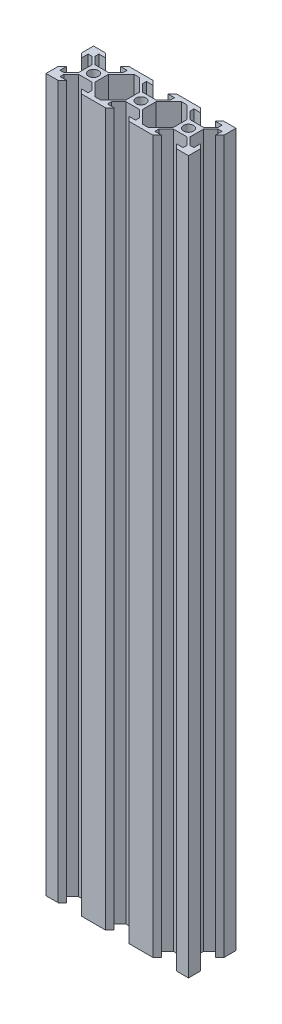
from build123d import *

# Parameters (mm, degrees)
EXTRUDE_1_DEPTH = 300


with BuildPart() as part:
    # 草图1 → 凸台-拉伸1 (new body)
    with BuildSketch(Plane(origin=(0, 0, 0), x_dir=(1, 0, 0), z_dir=(0, 1, 0))):
        with BuildLine():
            Line((-3.476396103, 2.84), (-3.476396103, 0))
            Line((-3.476396103, 0), (-2.1, 0))
            ThreePointArc((-2.1, 0), (-1.48492424, 1.48492424), (0, 2.1))
            Line((0, 2.1), (0, 3.476396103))
            Line((0, 3.476396103), (-2.84, 3.476396103))
            Line((-2.84, 3.476396103), (-5.923603897, 6.56))
            Line((-5.923603897, 6.56), (-5.923603897, 8.2))
            Line((-5.923603897, 8.2), (-3.1, 8.2))
            Line((-3.1, 8.2), (-4.9, 10))
            Line((-4.9, 10), (-10, 10))
            Line((-10, 10), (-10, 4.9))
            Line((-10, 4.9), (-8.2, 3.1))
            Line((-8.2, 3.1), (-8.2, 5.923603897))
            Line((-8.2, 5.923603897), (-6.56, 5.923603897))
            Line((-6.56, 5.923603897), (-3.476396103, 2.84))
        make_face()
        with BuildLine():
            Line((-2.1, 0), (-3.476396103, 0))
            Line((-3.476396103, 0), (-3.476396103, -2.84))
            Line((-3.476396103, -2.84), (-6.56, -5.923603897))
            Line((-6.56, -5.923603897), (-8.2, -5.923603897))
            Line((-8.2, -5.923603897), (-8.2, -3.1))
            Line((-8.2, -3.1), (-10, -4.9))
            Line((-10, -4.9), (-10, -10))
            Line((-10, -10), (-4.9, -10))
            Line((-4.9, -10), (-3.1, -8.2))
            Line((-3.1, -8.2), (-5.923603897, -8.2))
            Line((-5.923603897, -8.2), (-5.923603897, -6.56))
            Line((-5.923603897, -6.56), (-2.84, -3.476396103))
            Line((-2.84, -3.476396103), (0, -3.476396103))
            Line((0, -3.476396103), (0, -2.1))
            ThreePointArc((0, -2.1), (-1.48492424, -1.48492424), (-2.1, 0))
        make_face()
        with BuildLine():
            ThreePointArc((2.1, 0), (1.48492424, -1.48492424), (0, -2.1))
            Line((0, -2.1), (0, -3.476396103))
            Line((0, -3.476396103), (2.84, -3.476396103))
            Line((2.84, -3.476396103), (5.923603897, -6.56))
            Line((5.923603897, -6.56), (5.923603897, -8.2))
            Line((5.923603897, -8.2), (3.1, -8.2))
            Line((3.1, -8.2), (4.9, -10))
            Line((4.9, -10), (15.1, -10))
            Line((15.1, -10), (16.9, -8.2))
            Line((16.9, -8.2), (14.076396103, -8.2))
            Line((14.076396103, -8.2), (14.076396103, -6.56))
            Line((14.076396103, -6.56), (17.16, -3.476396103))
            Line((17.16, -3.476396103), (20, -3.476396103))
            Line((20, -3.476396103), (20, -2.1))
            ThreePointArc((20, -2.1), (18.51507576, -1.48492424), (17.9, 0))
            Line((17.9, 0), (16.523603897, 0))
            Line((16.523603897, 0), (16.523603897, -2.84))
            Line((16.523603897, -2.84), (13.44, -5.923603897))
            Line((13.44, -5.923603897), (11.163603897, -8.2))
            Line((11.163603897, -8.2), (8.836396103, -8.2))
            Line((8.836396103, -8.2), (6.56, -5.923603897))
            Line((6.56, -5.923603897), (3.476396103, -2.84))
            Line((3.476396103, -2.84), (3.476396103, 0))
            Line((3.476396103, 0), (2.1, 0))
        make_face()
        with BuildLine():
            Line((0, 3.476396103), (0, 2.1))
            ThreePointArc((0, 2.1), (1.48492424, 1.48492424), (2.1, 0))
            Line((2.1, 0), (3.476396103, 0))
            Line((3.476396103, 0), (3.476396103, 2.84))
            Line((3.476396103, 2.84), (6.56, 5.923603897))
            Line((6.56, 5.923603897), (8.836396103, 8.2))
            Line((8.836396103, 8.2), (11.163603897, 8.2))
            Line((11.163603897, 8.2), (13.44, 5.923603897))
            Line((13.44, 5.923603897), (16.523603897, 2.84))
            Line((16.523603897, 2.84), (16.523603897, 0))
            Line((16.523603897, 0), (17.9, 0))
            ThreePointArc((17.9, 0), (18.51507576, 1.48492424), (20, 2.1))
            Line((20, 2.1), (20, 3.476396103))
            Line((20, 3.476396103), (17.16, 3.476396103))
            Line((17.16, 3.476396103), (14.076396103, 6.56))
            Line((14.076396103, 6.56), (14.076396103, 8.2))
            Line((14.076396103, 8.2), (16.9, 8.2))
            Line((16.9, 8.2), (15.1, 10))
            Line((15.1, 10), (4.9, 10))
            Line((4.9, 10), (3.1, 8.2))
            Line((3.1, 8.2), (5.923603897, 8.2))
            Line((5.923603897, 8.2), (5.923603897, 6.56))
            Line((5.923603897, 6.56), (2.84, 3.476396103))
            Line((2.84, 3.476396103), (0, 3.476396103))
        make_face()
        with BuildLine():
            Line((20, 3.476396103), (20, 2.1))
            ThreePointArc((20, 2.1), (21.48492424, 1.48492424), (22.1, 0))
            Line((22.1, 0), (23.476396103, 0))
            Line((23.476396103, 0), (23.476396103, 2.84))
            Line((23.476396103, 2.84), (26.56, 5.923603897))
            Line((26.56, 5.923603897), (28.836396103, 8.2))
            Line((28.836396103, 8.2), (31.163603897, 8.2))
            Line((31.163603897, 8.2), (33.44, 5.923603897))
            Line((33.44, 5.923603897), (36.523603897, 2.84))
            Line((36.523603897, 2.84), (36.523603897, 0))
            Line((36.523603897, 0), (37.9, 0))
            ThreePointArc((37.9, 0), (40, 2.1), (42.1, 0))
            Line((42.1, 0), (43.476396103, 0))
            Line((43.476396103, 0), (43.476396103, 2.84))
            Line((43.476396103, 2.84), (46.56, 5.923603897))
            Line((46.56, 5.923603897), (48.2, 5.923603897))
            Line((48.2, 5.923603897), (48.2, 3.1))
            Line((48.2, 3.1), (50, 4.9))
            Line((50, 4.9), (50, 10))
            Line((50, 10), (44.9, 10))
            Line((44.9, 10), (43.1, 8.2))
            Line((43.1, 8.2), (45.923603897, 8.2))
            Line((45.923603897, 8.2), (45.923603897, 6.56))
            Line((45.923603897, 6.56), (42.84, 3.476396103))
            Line((42.84, 3.476396103), (37.16, 3.476396103))
            Line((37.16, 3.476396103), (34.076396103, 6.56))
            Line((34.076396103, 6.56), (34.076396103, 8.2))
            Line((34.076396103, 8.2), (36.9, 8.2))
            Line((36.9, 8.2), (35.1, 10))
            Line((35.1, 10), (24.9, 10))
            Line((24.9, 10), (23.1, 8.2))
            Line((23.1, 8.2), (25.923603897, 8.2))
            Line((25.923603897, 8.2), (25.923603897, 6.56))
            Line((25.923603897, 6.56), (22.84, 3.476396103))
            Line((22.84, 3.476396103), (20, 3.476396103))
        make_face()
        with BuildLine():
            ThreePointArc((22.1, 0), (21.48492424, -1.48492424), (20, -2.1))
            Line((20, -2.1), (20, -3.476396103))
            Line((20, -3.476396103), (22.84, -3.476396103))
            Line((22.84, -3.476396103), (25.923603897, -6.56))
            Line((25.923603897, -6.56), (25.923603897, -8.2))
            Line((25.923603897, -8.2), (23.1, -8.2))
            Line((23.1, -8.2), (24.9, -10))
            Line((24.9, -10), (35.1, -10))
            Line((35.1, -10), (36.9, -8.2))
            Line((36.9, -8.2), (34.076396103, -8.2))
            Line((34.076396103, -8.2), (34.076396103, -6.56))
            Line((34.076396103, -6.56), (37.16, -3.476396103))
            Line((37.16, -3.476396103), (42.84, -3.476396103))
            Line((42.84, -3.476396103), (45.923603897, -6.56))
            Line((45.923603897, -6.56), (45.923603897, -8.2))
            Line((45.923603897, -8.2), (43.1, -8.2))
            Line((43.1, -8.2), (44.9, -10))
            Line((44.9, -10), (50, -10))
            Line((50, -10), (50, -4.9))
            Line((50, -4.9), (48.2, -3.1))
            Line((48.2, -3.1), (48.2, -5.923603897))
            Line((48.2, -5.923603897), (46.56, -5.923603897))
            Line((46.56, -5.923603897), (43.476396103, -2.84))
            Line((43.476396103, -2.84), (43.476396103, 0))
            Line((43.476396103, 0), (42.1, 0))
            ThreePointArc((42.1, 0), (40, -2.1), (37.9, 0))
            Line((37.9, 0), (36.523603897, 0))
            Line((36.523603897, 0), (36.523603897, -2.84))
            Line((36.523603897, -2.84), (33.44, -5.923603897))
            Line((33.44, -5.923603897), (31.163603897, -8.2))
            Line((31.163603897, -8.2), (28.836396103, -8.2))
            Line((28.836396103, -8.2), (26.56, -5.923603897))
            Line((26.56, -5.923603897), (23.476396103, -2.84))
            Line((23.476396103, -2.84), (23.476396103, 0))
            Line((23.476396103, 0), (22.1, 0))
        make_face()
    extrude(amount=EXTRUDE_1_DEPTH)


solid = part.part
